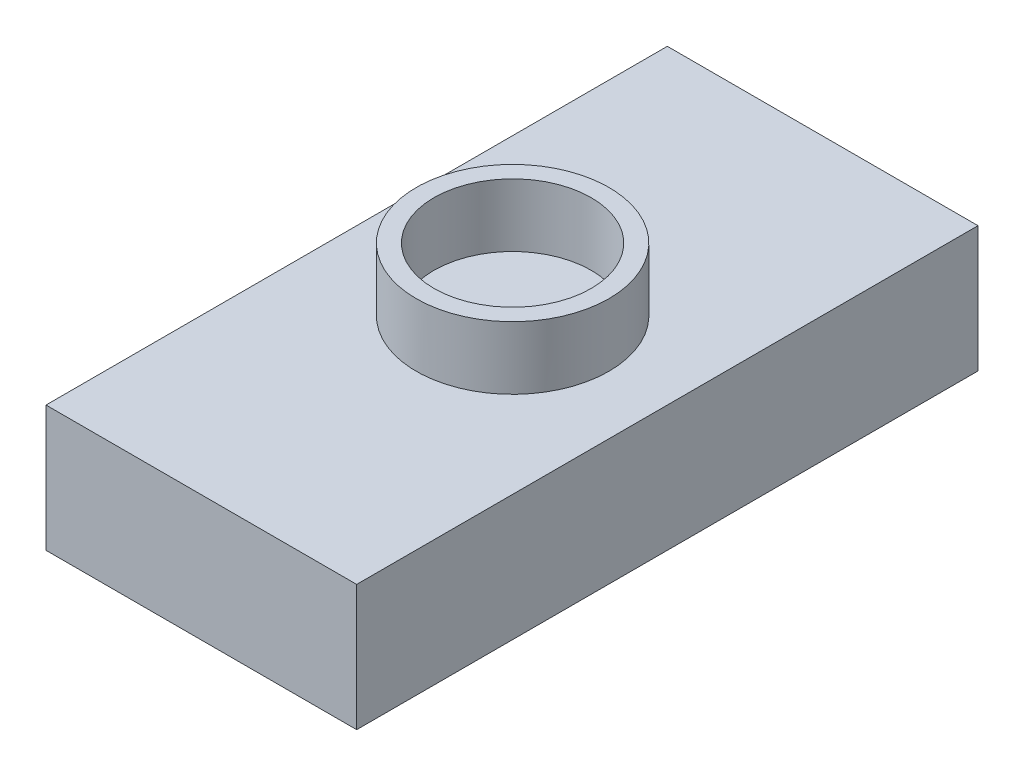
from build123d import *

# Parameters (mm, degrees)
MAINBASESKETCH_W                 = 7.9
MAINBASESKETCH_H                 = 3.2
MAINBASEEXTRUDE_DEPTH            = 7.9
MAINBASESHELL_T                  = -1.2
SLIMYELLOWUNDEREXT_START         = -0.2
SLIMYELLOWUNDEREXT_DEPTH         = 2
SLIMYELLLOWUPPERCIRCLESKETCH_R   = 2.45
SLIMYELLLOWUPPERCIRCLESKETCH_R_2 = 2
SLIMYELLOWUPPERCIRCLE_DEPTH      = 1.6


with BuildPart() as part:
    # MainBaseSketch → MainBaseExtrude (new, symmetric)
    with BuildSketch(Plane.XY):
        with Locations((4.631967213, 1.6)):
            Rectangle(MAINBASESKETCH_W, MAINBASESKETCH_H)
    extrude(amount=MAINBASEEXTRUDE_DEPTH, both=True)

    # MainBaseShell
    mainbaseshell_openings = [part.faces().sort_by_distance(p)[0] for p in [
        (4.631967213, 0, 0),
    ]]
    offset(amount=MAINBASESHELL_T, openings=mainbaseshell_openings, kind=Kind.INTERSECTION)

    # SlimYellowUnderExtSketch → SlimYellowUnderExt (add)
    with BuildSketch(Plane.XZ.offset(-2).offset(SLIMYELLOWUNDEREXT_START)):
        Polygon((6.683445552, 2.45), (7.181967213, 2.947188682), (7.381967213, 2.947188682), (7.381967213, 1.952811318), (7.181967213, 1.952811318), align=None)
        Polygon((1.881967213, 1.952811318), (1.881967213, 2.947188682), (2.081967213, 2.947188682), (2.580488874, 2.45), (2.081967213, 1.952811318), align=None)
        Polygon((2.580488874, -2.45), (2.081967213, -2.947188682), (1.881967213, -2.947188682), (1.881967213, -1.952811318), (2.081967213, -1.952811318), align=None)
        Polygon((6.683445552, -2.45), (7.181967213, -1.952811318), (7.381967213, -1.952811318), (7.381967213, -2.947188682), (7.181967213, -2.947188682), align=None)
    extrude(amount=SLIMYELLOWUNDEREXT_DEPTH)

    # SlimYelllowUpperCircleSketch → SlimYellowUpperCircle (add)
    with BuildSketch(Plane(origin=(0, 3.2, 0), x_dir=(1, 0, 0), z_dir=(0, 1, 0))):
        with Locations((4.647335619, 0)):
            Circle(SLIMYELLLOWUPPERCIRCLESKETCH_R)
        with Locations(Location((4.647335619, 0, 0), (0, 0, 270))):
            Circle(SLIMYELLLOWUPPERCIRCLESKETCH_R_2, mode=Mode.SUBTRACT)
    extrude(amount=SLIMYELLOWUPPERCIRCLE_DEPTH)


solid = part.part
